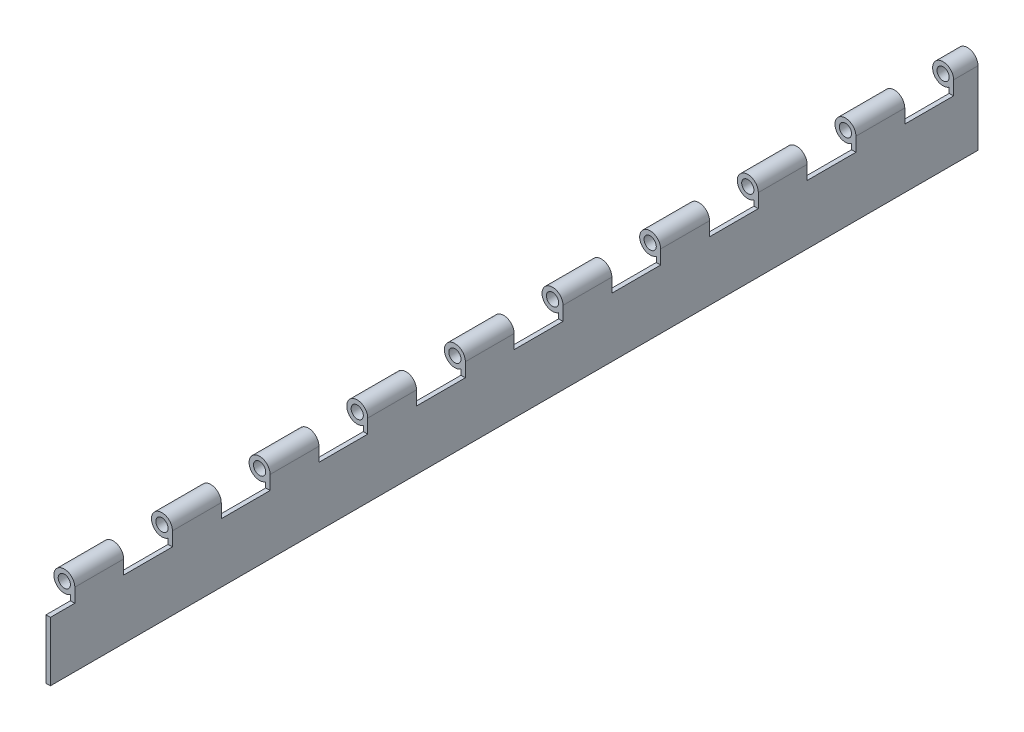
from build123d import *

# Parameters (mm, degrees)
SKETCH1_R           = 3.175
BOSS_EXTRUDE1_DEPTH = 508
SKETCH2_W           = 25.4
SKETCH2_H           = 12.7
CUT_EXTRUDE1_DEPTH  = 510.543815667
LPATTERN1_COUNT     = 10
LPATTERN1_PITCH     = 50.8
SKETCH4_W           = 12.7
SKETCH4_H           = 30.861
SKETCH4_H_2         = 43.561
CUT_EXTRUDE2_DEPTH  = 510.543815667


with BuildPart() as part:
    # Sketch1 → Boss-Extrude1 (new body)
    with BuildSketch(Plane.XY):
        with BuildLine():
            Line((5.461, 0), (5.461, -38.1))
            Line((5.461, -38.1), (3.175, -38.1))
            Line((3.175, -38.1), (3.175, -4.443185344))
            ThreePointArc((3.175, -4.443185344), (-4.855985791, 2.498384078), (5.461, 0))
        make_face()
        Circle(SKETCH1_R, mode=Mode.SUBTRACT)
    extrude(amount=BOSS_EXTRUDE1_DEPTH)

    # Sketch2 → Cut-Extrude1 (cut, through all)
    with BuildSketch(Plane(origin=(5.461, 0, 0), x_dir=(0, 0, -1), z_dir=(1, 0, 0))):
        with Locations((-495.3, -0.889)):
            Rectangle(SKETCH2_W, SKETCH2_H)
    cut_extrude1 = extrude(amount=-CUT_EXTRUDE1_DEPTH, mode=Mode.SUBTRACT)

    # LPattern1: Cut-Extrude1 ×10
    with Locations(*[(0, 0, -i * LPATTERN1_PITCH) for i in range(1, LPATTERN1_COUNT)]):
        add(cut_extrude1, mode=Mode.SUBTRACT)

    # Sketch4 → Cut-Extrude2 (cut, through all)
    with BuildSketch(Plane(origin=(5.461, 0, 0), x_dir=(0, 0, -1), z_dir=(1, 0, 0))):
        with Locations((-501.65, -22.6695)):
            Rectangle(SKETCH4_W, SKETCH4_H)
        with Locations((-6.35, -16.3195)):
            Rectangle(SKETCH4_W, SKETCH4_H_2)
    extrude(amount=-CUT_EXTRUDE2_DEPTH, mode=Mode.SUBTRACT)


solid = part.part
